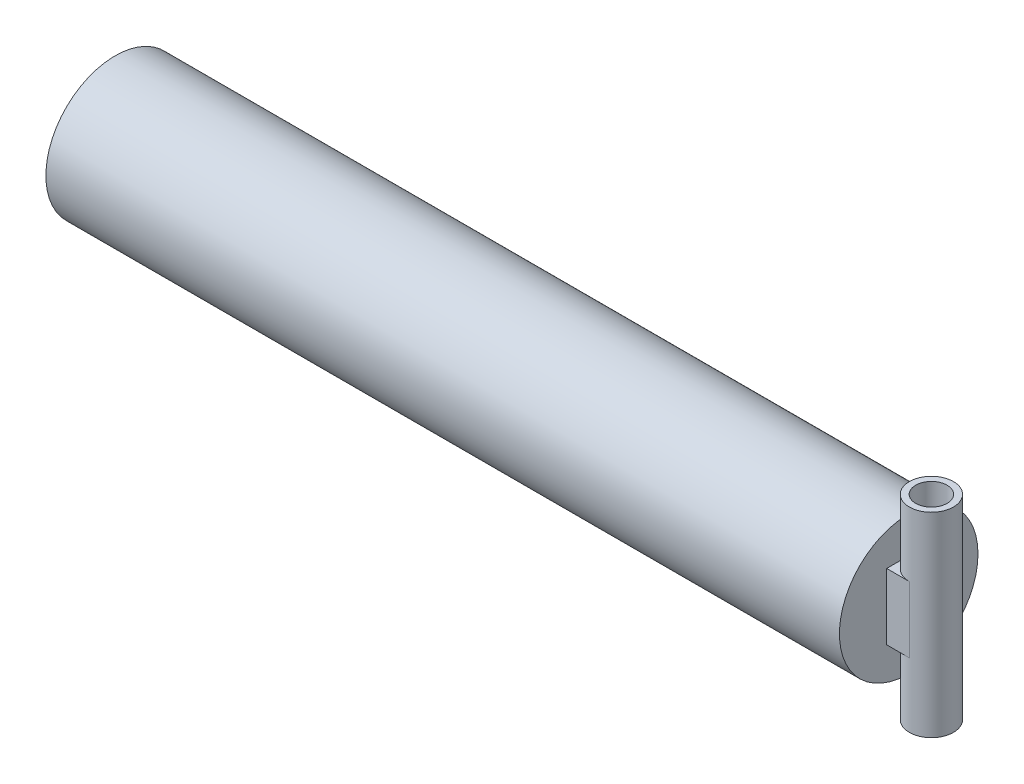
from build123d import *

# Parameters (mm, degrees)
CILINDAR_SHELL1_T                 = -10
CILINDAR_SKETCH3_W                = 30
CILINDAR_SKETCH3_H                = 10
CILINDAR_BOSS_EXTRUDE1_DEPTH      = 155
CILINDAR_BOSS_EXTRUDE1_DEPTH_BACK = 155
CILINDAR_SKETCH2_R                = 35
CILINDAR_SKETCH2_R_2              = 25
CILINDAR_BOSS_EXTRUDE7_REACH      = 1276.255
CILINDAR_SKETCH6_W                = 70
CILINDAR_SKETCH6_H                = 105
CILINDAR_SKETCH7_R                = 90
CILINDAR_SKETCH7_R_2              = 25
CILINDAR_BOSS_EXTRUDE8_DEPTH      = 10


with BuildPart() as part:
    # cilindar_Sketch1 → cilindar_Revolve1 (revolve)
    with BuildSketch(Plane(origin=(0, 0, 0), x_dir=(1, 0, 0), z_dir=(0, 1, 0))):
        Polygon((-630, 100), (-630, 0), (630, 0), (630, 100), (600, 100), (600, 110), (-600, 110), (-600, 100), align=None)
    revolve(axis=Axis((-630, 0, 0), (1, 0, 0)))

    # cilindar_Shell1
    cilindar_shell1_openings = [part.faces().sort_by_distance(p)[0] for p in [
        (-630, 0, 0),
    ]]
    offset(amount=CILINDAR_SHELL1_T, openings=cilindar_shell1_openings, kind=Kind.INTERSECTION)

    # cilindar_Sketch3 → cilindar_Revolve2 (revolve)
    with BuildSketch(Plane(origin=(0, 0, 0), x_dir=(1, 0, 0), z_dir=(0, 1, 0))):
        with Locations((-615, 105)):
            Rectangle(CILINDAR_SKETCH3_W, CILINDAR_SKETCH3_H)
    cilindar_revolve2 = revolve(axis=Axis((590, 0, 0), (-1, 0, 0)))

    # cilindar_Mirror2: cilindar_Revolve2 across plane
    add(cilindar_revolve2.mirror(Plane(origin=(0, 0, 0), x_dir=(0, 0, 1), z_dir=(1, 0, 0))))


with BuildPart() as body_2:
    # cilindar_Sketch2 → cilindar_Boss-Extrude1 (new, two sides: drawn at the far end of the back side and taken through both)
    with BuildSketch(Plane(origin=(0, 0, 0), x_dir=(1, 0, 0), z_dir=(0, 1, 0)).offset(-CILINDAR_BOSS_EXTRUDE1_DEPTH_BACK)):
        with Locations((666, 0)):
            Circle(CILINDAR_SKETCH2_R)
        with Locations((666, 0)):
            Circle(CILINDAR_SKETCH2_R_2, mode=Mode.SUBTRACT)
    extrude(amount=CILINDAR_BOSS_EXTRUDE1_DEPTH + CILINDAR_BOSS_EXTRUDE1_DEPTH_BACK)

    # cilindar_Sketch6 → cilindar_Boss-Extrude7 (add, up to next)
    with BuildSketch(Plane(origin=(630, 0, 0), x_dir=(0, 0, -1), z_dir=(1, 0, 0)), mode=Mode.PRIVATE) as cilindar_boss_extrude7_sk1:
        Rectangle(CILINDAR_SKETCH6_W, CILINDAR_SKETCH6_H)
    cilindar_boss_extrude7_tool1 = extrude(cilindar_boss_extrude7_sk1.sketch, amount=CILINDAR_BOSS_EXTRUDE7_REACH, mode=Mode.PRIVATE) - body_2.part

    add(part.part)  # cilindar_Boss-Extrude7 merges part
    add(cilindar_boss_extrude7_tool1.solids().sort_by_distance((630, 0, 0))[0])

    # cilindar_Sketch7 → cilindar_Boss-Extrude8 (add)
    with BuildSketch(Plane.ZY.offset(630)):
        Circle(CILINDAR_SKETCH7_R)
        Circle(CILINDAR_SKETCH7_R_2, mode=Mode.SUBTRACT)
    extrude(amount=-CILINDAR_BOSS_EXTRUDE8_DEPTH)


solid = body_2.part
